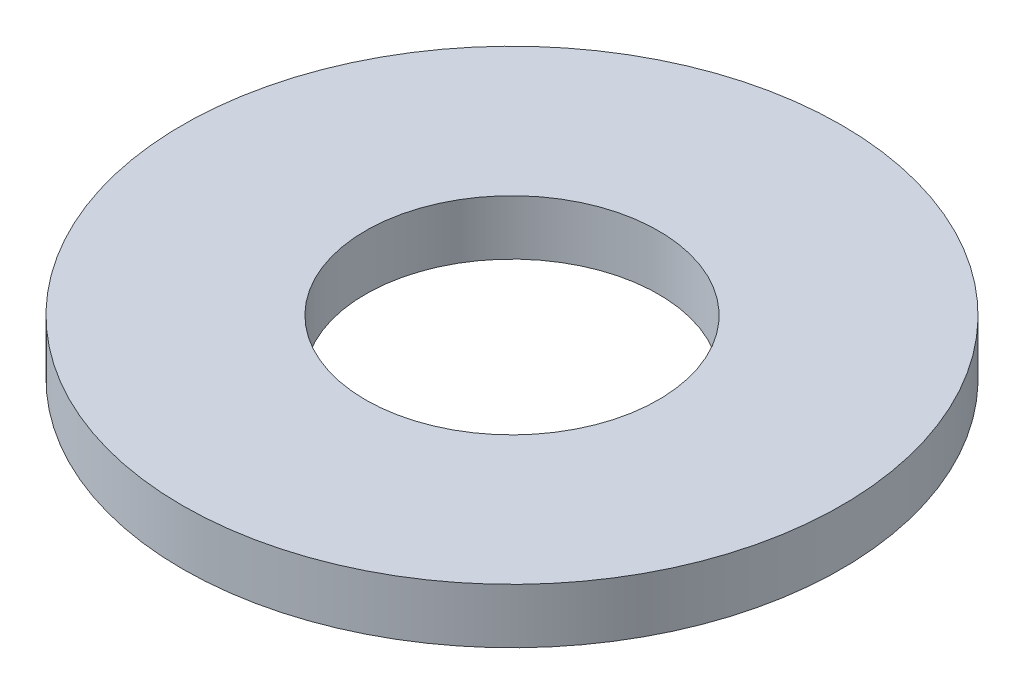
from build123d import *

# Parameters (mm, degrees)
SKETCH1_R           = 9
SKETCH1_R_2         = 4
BOSS_EXTRUDE1_DEPTH = 1.5


with BuildPart() as part:
    # Sketch1 → Boss-Extrude1 (new body)
    with BuildSketch(Plane(origin=(0, 0, 0), x_dir=(1, 0, 0), z_dir=(0, 1, 0))):
        with Locations(Location((0, 0, 0), (0, 0, 270))):
            Circle(SKETCH1_R)
        with Locations(Location((0, 0, 0), (0, 0, 270))):
            Circle(SKETCH1_R_2, mode=Mode.SUBTRACT)
    extrude(amount=BOSS_EXTRUDE1_DEPTH)


solid = part.part
